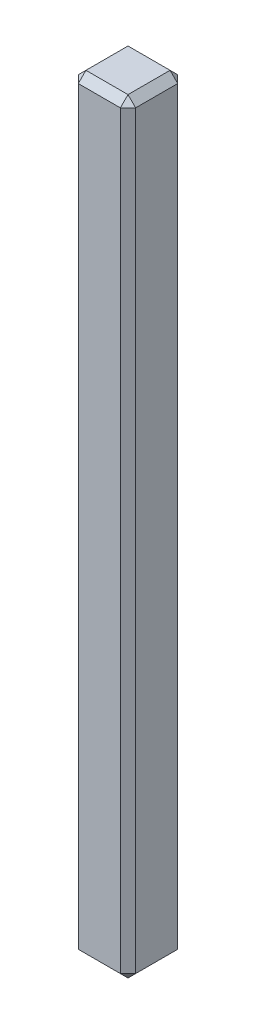
from build123d import *

# Parameters (mm, degrees)
SKETCH1_W           = 15
SKETCH1_H           = 15
BOSS_EXTRUDE1_DEPTH = 200
CHAMFER1_SIZE       = 2


with BuildPart() as part:
    # Sketch1 → Boss-Extrude1 (new body)
    with BuildSketch(Plane(origin=(0, 0, 0), x_dir=(1, 0, 0), z_dir=(0, 1, 0))):
        with Locations((7.5, 7.5)):
            Rectangle(SKETCH1_W, SKETCH1_H)
    extrude(amount=BOSS_EXTRUDE1_DEPTH)

    # Chamfer1
    chamfer1_edges = [part.edges().sort_by_distance(p)[0] for p in [
        (15, 200, -7.5),
        (7.5, 200, -15),
        (0, 200, -7.5),
        (7.5, 0, -15),
        (15, 0, -7.5),
        (7.5, 0, 0),
        (0, 0, -7.5),
        (0, 100, -15),
        (15, 100, -15),
        (15, 100, 0),
        (0, 100, 0),
        (7.5, 200, 0),
    ]]
    chamfer(chamfer1_edges, length=CHAMFER1_SIZE)


solid = part.part
